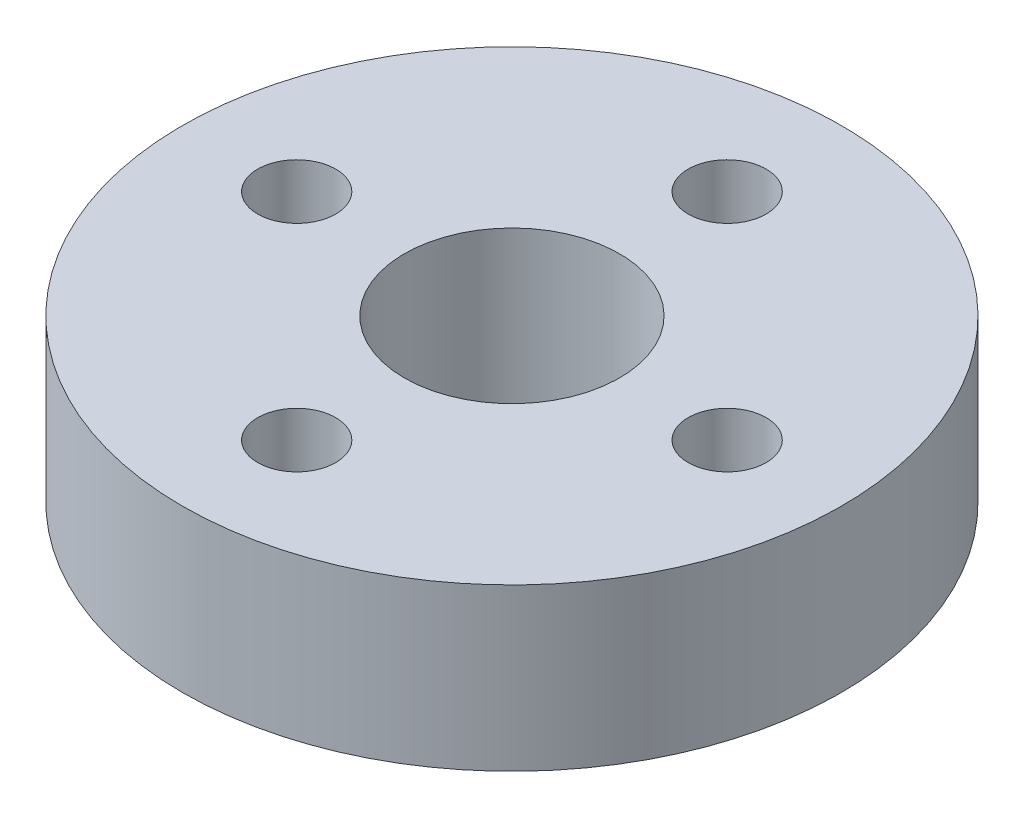
from build123d import *

# Parameters (mm, degrees)
SKETCH_1_R      = 12.25
SKETCH_1_R_2    = 4
SKETCH_1_R_3    = 1.45
EXTRUDE_1_DEPTH = 6


with BuildPart() as part:
    # 草图1 → 凸台-拉伸1 (new body)
    with BuildSketch(Plane(origin=(0, 0, 0), x_dir=(1, 0, 0), z_dir=(0, 1, 0))):
        with Locations(Location((0, 0, 0), (0, 0, 270))):
            Circle(SKETCH_1_R)
        with Locations(Location((0, 0, 0), (0, 0, 270))):
            Circle(SKETCH_1_R_2, mode=Mode.SUBTRACT)
        with Locations(Location((0, 8, 0), (0, 0, 270))):
            Circle(SKETCH_1_R_3, mode=Mode.SUBTRACT)
        with Locations(Location((8, 0, 0), (0, 0, 270))):
            Circle(SKETCH_1_R_3, mode=Mode.SUBTRACT)
        with Locations(Location((0, -8, 0), (0, 0, 270))):
            Circle(SKETCH_1_R_3, mode=Mode.SUBTRACT)
        with Locations(Location((-8, 0, 0), (0, 0, 270))):
            Circle(SKETCH_1_R_3, mode=Mode.SUBTRACT)
    extrude(amount=EXTRUDE_1_DEPTH)


solid = part.part
